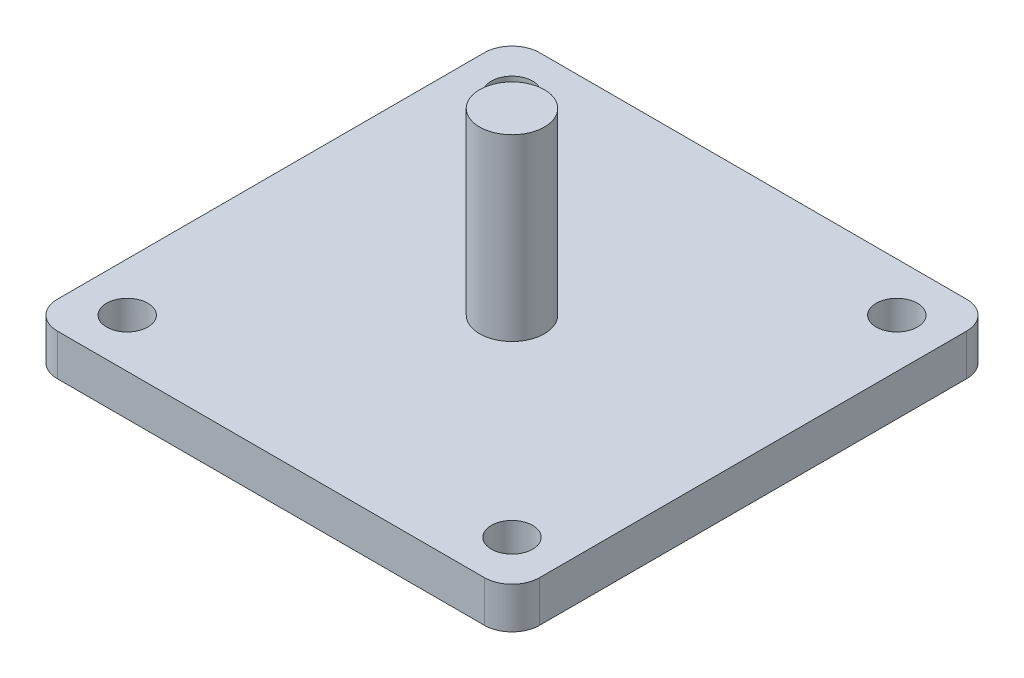
from build123d import *

# Parameters (mm, degrees)
ESBO_O1_W                = 35
ESBO_O1_H                = 35
RESSALTO_EXTRUS_O1_DEPTH = 1.5
FILETE1_R                = 2
ESBO_O2_R                = 2.35
RESSALTO_EXTRUS_O2_DEPTH = 13
ESBO_O3_R                = 1.5
CORTE_EXTRUS_O1_DEPTH    = 10


with BuildPart() as part:
    # Esboço1 → Ressalto-extrusão1 (new, symmetric)
    with BuildSketch(Plane(origin=(0, 0, 0), x_dir=(1, 0, 0), z_dir=(0, 1, 0))):
        Rectangle(ESBO_O1_W, ESBO_O1_H)
    extrude(amount=RESSALTO_EXTRUS_O1_DEPTH, both=True)

    # Filete1
    filete1_edges = [part.edges().sort_by_distance(p)[0] for p in [
        (17.5, 0, 17.5),
        (-17.5, 0, 17.5),
        (-17.5, 0, -17.5),
        (17.5, 0, -17.5),
    ]]
    fillet(filete1_edges, radius=FILETE1_R)

    # Esboço2 → Ressalto-extrusão2 (add)
    with BuildSketch(Plane(origin=(0, 1.5, 0), x_dir=(1, 0, 0), z_dir=(0, 1, 0))):
        with Locations(Location((0, 0, 0), (0, 0, 90))):
            Circle(ESBO_O2_R)
    extrude(amount=RESSALTO_EXTRUS_O2_DEPTH)

    # Esboço3 → Corte-extrusão1 (cut)
    with BuildSketch(Plane(origin=(0, 1.5, 0), x_dir=(1, 0, 0), z_dir=(0, 1, 0))):
        with Locations(Location((13.964466094, 13.964466094, 0), (0, 0, 270))):
            Circle(ESBO_O3_R)
        with Locations(Location((13.964466094, -13.964466094, 0), (0, 0, 270))):
            Circle(ESBO_O3_R)
        with Locations(Location((-13.964466094, -13.964466094, 0), (0, 0, 270))):
            Circle(ESBO_O3_R)
        with Locations(Location((-13.964466094, 13.964466094, 0), (0, 0, 270))):
            Circle(ESBO_O3_R)
    extrude(amount=-CORTE_EXTRUS_O1_DEPTH, mode=Mode.SUBTRACT)


solid = part.part
